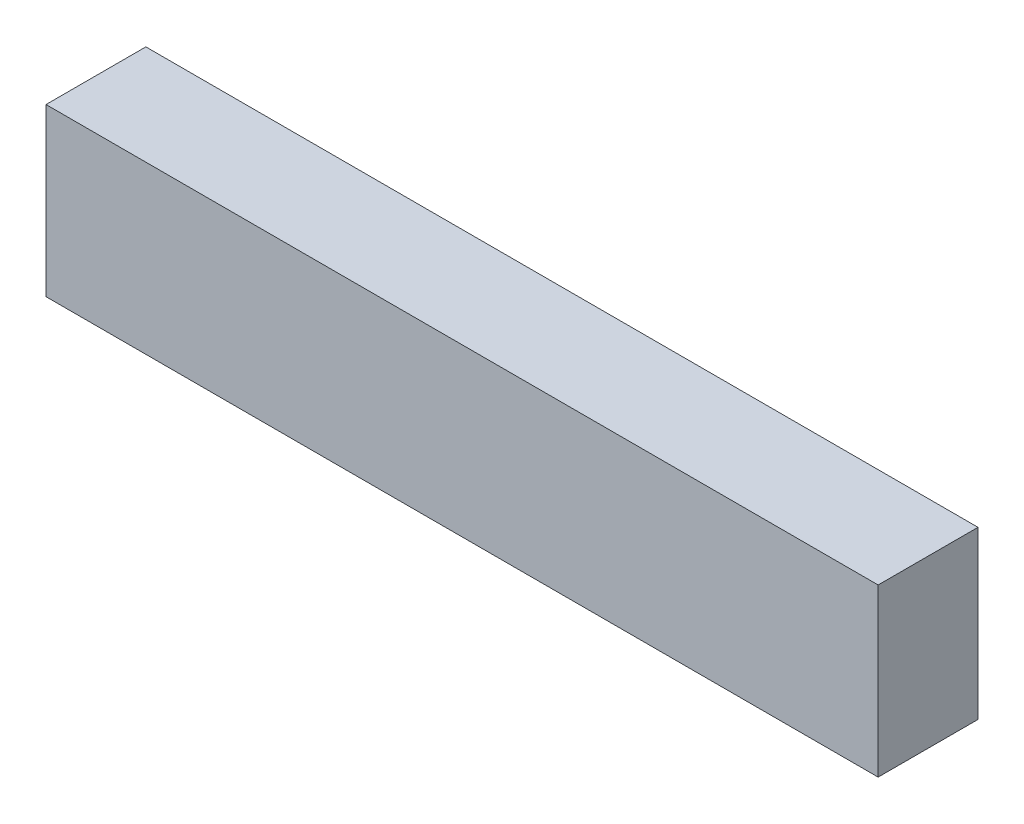
from build123d import *

# Parameters (mm, degrees)
SKETCH1_W           = 50
SKETCH1_H           = 10
BOSS_EXTRUDE1_DEPTH = 6


with BuildPart() as part:
    # Sketch1 → Boss-Extrude1 (new body)
    with BuildSketch(Plane.XY):
        with Locations((25, 5)):
            Rectangle(SKETCH1_W, SKETCH1_H)
    extrude(amount=BOSS_EXTRUDE1_DEPTH)


solid = part.part
